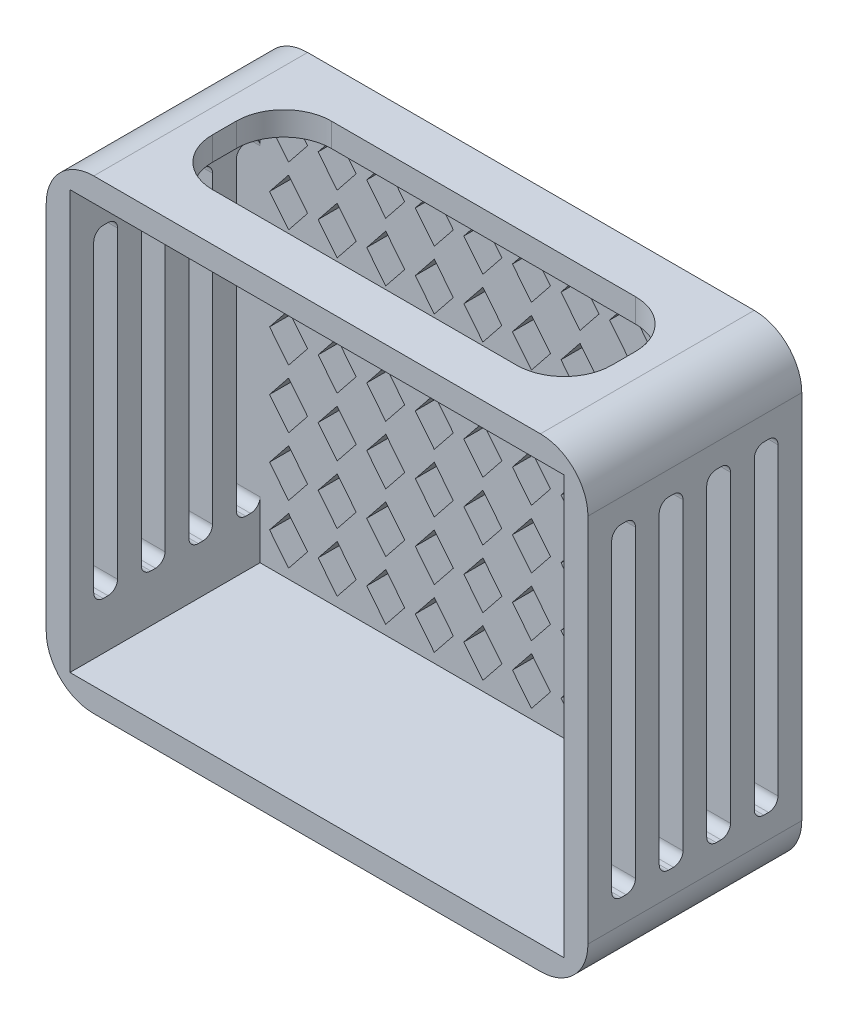
from build123d import *

# Parameters (mm, degrees)
SKETCH_1_W          = 114
SKETCH_1_H          = 98
EXTRUDE_2_DEPTH     = 45
SKETCH_3_W          = 104
SKETCH_3_H          = 88
CUT_EXTRUDE_2_DEPTH = 40
FILLET_1_R          = 10
FILLET_2_R          = 10
FILLET_3_R          = 10
FILLET_4_R          = 10
CUT_EXTRUDE_3_DEPTH = 10
CUT_EXTRUDE_4_DEPTH = 10
CUT_EXTRUDE_5_DEPTH = 150


with BuildPart() as part:
    # 草图1 → 凸台-拉伸2 (new body)
    with BuildSketch(Plane.XY):
        with Locations((57, 49)):
            Rectangle(SKETCH_1_W, SKETCH_1_H)
    extrude(amount=-EXTRUDE_2_DEPTH)

    # 草图3 → 切除-拉伸2 (cut)
    with BuildSketch(Plane.XY):
        with Locations((57, 49)):
            Rectangle(SKETCH_3_W, SKETCH_3_H)
    extrude(amount=-CUT_EXTRUDE_2_DEPTH, mode=Mode.SUBTRACT)

    # 圆角1
    fillet_1_edges = [part.edges().sort_by_distance(p)[0] for p in [
        (0, 98, -22.5),
    ]]
    fillet(fillet_1_edges, radius=FILLET_1_R)

    # 圆角2
    fillet_2_edges = [part.edges().sort_by_distance(p)[0] for p in [
        (0, 0, -22.5),
    ]]
    fillet(fillet_2_edges, radius=FILLET_2_R)

    # 圆角3
    fillet_3_edges = [part.edges().sort_by_distance(p)[0] for p in [
        (114, 0, -22.5),
    ]]
    fillet(fillet_3_edges, radius=FILLET_3_R)

    # 圆角4
    fillet_4_edges = [part.edges().sort_by_distance(p)[0] for p in [
        (114, 98, -22.5),
    ]]
    fillet(fillet_4_edges, radius=FILLET_4_R)

    # 草图5 → 切除-拉伸3 (cut)
    with BuildSketch(Plane(origin=(0, 0, -45), x_dir=(-1, 0, 0), z_dir=(0, 0, -1))):
        Polygon((-103, 91), (-107, 86), (-103, 81), (-99, 86), align=None)
        Polygon((-92.777777778, 91), (-96.777777778, 86), (-92.777777778, 81), (-88.777777778, 86), align=None)
        Polygon((-82.555555556, 91), (-86.555555556, 86), (-82.555555556, 81), (-78.555555556, 86), align=None)
        Polygon((-72.333333333, 91), (-76.333333333, 86), (-72.333333333, 81), (-68.333333333, 86), align=None)
        Polygon((-62.111111111, 91), (-66.111111111, 86), (-62.111111111, 81), (-58.111111111, 86), align=None)
        Polygon((-51.888888889, 91), (-55.888888889, 86), (-51.888888889, 81), (-47.888888889, 86), align=None)
        Polygon((-41.666666667, 91), (-45.666666667, 86), (-41.666666667, 81), (-37.666666667, 86), align=None)
        Polygon((-31.444444444, 91), (-35.444444444, 86), (-31.444444444, 81), (-27.444444444, 86), align=None)
        Polygon((-21.222222222, 91), (-25.222222222, 86), (-21.222222222, 81), (-17.222222222, 86), align=None)
        Polygon((-11, 91), (-15, 86), (-11, 81), (-7, 86), align=None)
        Polygon((-92.777777778, 78.666666667), (-96.777777778, 73.666666667), (-92.777777778, 68.666666667), (-88.777777778, 73.666666667), align=None)
        Polygon((-82.555555556, 78.666666667), (-86.555555556, 73.666666667), (-82.555555556, 68.666666667), (-78.555555556, 73.666666667), align=None)
        Polygon((-72.333333333, 78.666666667), (-76.333333333, 73.666666667), (-72.333333333, 68.666666667), (-68.333333333, 73.666666667), align=None)
        Polygon((-62.111111111, 78.666666667), (-66.111111111, 73.666666667), (-62.111111111, 68.666666667), (-58.111111111, 73.666666667), align=None)
        Polygon((-51.888888889, 78.666666667), (-55.888888889, 73.666666667), (-51.888888889, 68.666666667), (-47.888888889, 73.666666667), align=None)
        Polygon((-41.666666667, 78.666666667), (-45.666666667, 73.666666667), (-41.666666667, 68.666666667), (-37.666666667, 73.666666667), align=None)
        Polygon((-31.444444444, 78.666666667), (-35.444444444, 73.666666667), (-31.444444444, 68.666666667), (-27.444444444, 73.666666667), align=None)
        Polygon((-21.222222222, 78.666666667), (-25.222222222, 73.666666667), (-21.222222222, 68.666666667), (-17.222222222, 73.666666667), align=None)
        Polygon((-11, 78.666666667), (-15, 73.666666667), (-11, 68.666666667), (-7, 73.666666667), align=None)
        Polygon((-92.777777778, 66.333333333), (-96.777777778, 61.333333333), (-92.777777778, 56.333333333), (-88.777777778, 61.333333333), align=None)
        Polygon((-82.555555556, 66.333333333), (-86.555555556, 61.333333333), (-82.555555556, 56.333333333), (-78.555555556, 61.333333333), align=None)
        Polygon((-72.333333333, 66.333333333), (-76.333333333, 61.333333333), (-72.333333333, 56.333333333), (-68.333333333, 61.333333333), align=None)
        Polygon((-62.111111111, 66.333333333), (-66.111111111, 61.333333333), (-62.111111111, 56.333333333), (-58.111111111, 61.333333333), align=None)
        Polygon((-51.888888889, 66.333333333), (-55.888888889, 61.333333333), (-51.888888889, 56.333333333), (-47.888888889, 61.333333333), align=None)
        Polygon((-41.666666667, 66.333333333), (-45.666666667, 61.333333333), (-41.666666667, 56.333333333), (-37.666666667, 61.333333333), align=None)
        Polygon((-31.444444444, 66.333333333), (-35.444444444, 61.333333333), (-31.444444444, 56.333333333), (-27.444444444, 61.333333333), align=None)
        Polygon((-21.222222222, 66.333333333), (-25.222222222, 61.333333333), (-21.222222222, 56.333333333), (-17.222222222, 61.333333333), align=None)
        Polygon((-11, 66.333333333), (-15, 61.333333333), (-11, 56.333333333), (-7, 61.333333333), align=None)
        Polygon((-92.777777778, 54), (-96.777777778, 49), (-92.777777778, 44), (-88.777777778, 49), align=None)
        Polygon((-82.555555556, 54), (-86.555555556, 49), (-82.555555556, 44), (-78.555555556, 49), align=None)
        Polygon((-72.333333333, 54), (-76.333333333, 49), (-72.333333333, 44), (-68.333333333, 49), align=None)
        Polygon((-62.111111111, 54), (-66.111111111, 49), (-62.111111111, 44), (-58.111111111, 49), align=None)
        Polygon((-51.888888889, 54), (-55.888888889, 49), (-51.888888889, 44), (-47.888888889, 49), align=None)
        Polygon((-41.666666667, 54), (-45.666666667, 49), (-41.666666667, 44), (-37.666666667, 49), align=None)
        Polygon((-31.444444444, 54), (-35.444444444, 49), (-31.444444444, 44), (-27.444444444, 49), align=None)
        Polygon((-21.222222222, 54), (-25.222222222, 49), (-21.222222222, 44), (-17.222222222, 49), align=None)
        Polygon((-11, 54), (-15, 49), (-11, 44), (-7, 49), align=None)
        Polygon((-92.777777778, 41.666666667), (-96.777777778, 36.666666667), (-92.777777778, 31.666666667), (-88.777777778, 36.666666667), align=None)
        Polygon((-82.555555556, 41.666666667), (-86.555555556, 36.666666667), (-82.555555556, 31.666666667), (-78.555555556, 36.666666667), align=None)
        Polygon((-72.333333333, 41.666666667), (-76.333333333, 36.666666667), (-72.333333333, 31.666666667), (-68.333333333, 36.666666667), align=None)
        Polygon((-62.111111111, 41.666666667), (-66.111111111, 36.666666667), (-62.111111111, 31.666666667), (-58.111111111, 36.666666667), align=None)
        Polygon((-51.888888889, 41.666666667), (-55.888888889, 36.666666667), (-51.888888889, 31.666666667), (-47.888888889, 36.666666667), align=None)
        Polygon((-41.666666667, 41.666666667), (-45.666666667, 36.666666667), (-41.666666667, 31.666666667), (-37.666666667, 36.666666667), align=None)
        Polygon((-31.444444444, 41.666666667), (-35.444444444, 36.666666667), (-31.444444444, 31.666666667), (-27.444444444, 36.666666667), align=None)
        Polygon((-21.222222222, 41.666666667), (-25.222222222, 36.666666667), (-21.222222222, 31.666666667), (-17.222222222, 36.666666667), align=None)
        Polygon((-11, 41.666666667), (-15, 36.666666667), (-11, 31.666666667), (-7, 36.666666667), align=None)
        Polygon((-92.777777778, 29.333333333), (-96.777777778, 24.333333333), (-92.777777778, 19.333333333), (-88.777777778, 24.333333333), align=None)
        Polygon((-82.555555556, 29.333333333), (-86.555555556, 24.333333333), (-82.555555556, 19.333333333), (-78.555555556, 24.333333333), align=None)
        Polygon((-72.333333333, 29.333333333), (-76.333333333, 24.333333333), (-72.333333333, 19.333333333), (-68.333333333, 24.333333333), align=None)
        Polygon((-62.111111111, 29.333333333), (-66.111111111, 24.333333333), (-62.111111111, 19.333333333), (-58.111111111, 24.333333333), align=None)
        Polygon((-51.888888889, 29.333333333), (-55.888888889, 24.333333333), (-51.888888889, 19.333333333), (-47.888888889, 24.333333333), align=None)
        Polygon((-41.666666667, 29.333333333), (-45.666666667, 24.333333333), (-41.666666667, 19.333333333), (-37.666666667, 24.333333333), align=None)
        Polygon((-31.444444444, 29.333333333), (-35.444444444, 24.333333333), (-31.444444444, 19.333333333), (-27.444444444, 24.333333333), align=None)
        Polygon((-21.222222222, 29.333333333), (-25.222222222, 24.333333333), (-21.222222222, 19.333333333), (-17.222222222, 24.333333333), align=None)
        Polygon((-11, 29.333333333), (-15, 24.333333333), (-11, 19.333333333), (-7, 24.333333333), align=None)
        Polygon((-92.777777778, 17), (-96.777777778, 12), (-92.777777778, 7), (-88.777777778, 12), align=None)
        Polygon((-82.555555556, 17), (-86.555555556, 12), (-82.555555556, 7), (-78.555555556, 12), align=None)
        Polygon((-72.333333333, 17), (-76.333333333, 12), (-72.333333333, 7), (-68.333333333, 12), align=None)
        Polygon((-62.111111111, 17), (-66.111111111, 12), (-62.111111111, 7), (-58.111111111, 12), align=None)
        Polygon((-51.888888889, 17), (-55.888888889, 12), (-51.888888889, 7), (-47.888888889, 12), align=None)
        Polygon((-41.666666667, 17), (-45.666666667, 12), (-41.666666667, 7), (-37.666666667, 12), align=None)
        Polygon((-31.444444444, 17), (-35.444444444, 12), (-31.444444444, 7), (-27.444444444, 12), align=None)
        Polygon((-21.222222222, 17), (-25.222222222, 12), (-21.222222222, 7), (-17.222222222, 12), align=None)
        Polygon((-11, 17), (-15, 12), (-11, 7), (-7, 12), align=None)
        Polygon((-103, 78.666666667), (-107, 73.666666667), (-103, 68.666666667), (-99, 73.666666667), align=None)
        Polygon((-103, 66.333333333), (-107, 61.333333333), (-103, 56.333333333), (-99, 61.333333333), align=None)
        Polygon((-103, 54), (-107, 49), (-103, 44), (-99, 49), align=None)
        Polygon((-103, 41.666666667), (-107, 36.666666667), (-103, 31.666666667), (-99, 36.666666667), align=None)
        Polygon((-103, 29.333333333), (-107, 24.333333333), (-103, 19.333333333), (-99, 24.333333333), align=None)
        Polygon((-103, 17), (-107, 12), (-103, 7), (-99, 12), align=None)
    extrude(amount=-CUT_EXTRUDE_3_DEPTH, mode=Mode.SUBTRACT)

    # 草图4 → 切除-拉伸4 (cut)
    with BuildSketch(Plane(origin=(0, 98, 0), x_dir=(1, 0, 0), z_dir=(0, 1, 0))):
        with BuildLine():
            Line((25, 35), (89, 35))
            ThreePointArc((89, 35), (96.071067812, 32.071067812), (99, 25))
            Line((99, 25), (99, 20))
            ThreePointArc((99, 20), (96.071067812, 12.928932188), (89, 10))
            Line((89, 10), (25, 10))
            ThreePointArc((25, 10), (17.928932188, 12.928932188), (15, 20))
            Line((15, 20), (15, 25))
            ThreePointArc((15, 25), (17.928932188, 32.071067812), (25, 35))
        make_face()
    extrude(amount=-CUT_EXTRUDE_4_DEPTH, mode=Mode.SUBTRACT)

    # 草图6 → 切除-拉伸5 (cut)
    with BuildSketch(Plane(origin=(114, 0, 0), x_dir=(0, 0, -1), z_dir=(1, 0, 0))):
        with BuildLine():
            Line((15, 81), (15, 17))
            ThreePointArc((15, 17), (15.585786438, 15.585786438), (17, 15))
            Line((17, 15), (18, 15))
            ThreePointArc((18, 15), (19.414213562, 15.585786438), (20, 17))
            Line((20, 17), (20, 81))
            ThreePointArc((20, 81), (19.414213562, 82.414213562), (18, 83))
            Line((18, 83), (17, 83))
            ThreePointArc((17, 83), (15.585786438, 82.414213562), (15, 81))
        make_face()
        with BuildLine():
            Line((7, 83), (8, 83))
            ThreePointArc((8, 83), (9.414213562, 82.414213562), (10, 81))
            Line((10, 81), (10, 17))
            ThreePointArc((10, 17), (9.414213562, 15.585786438), (8, 15))
            Line((8, 15), (7, 15))
            ThreePointArc((7, 15), (5.585786438, 15.585786438), (5, 17))
            Line((5, 17), (5, 81))
            ThreePointArc((5, 81), (5.585786438, 82.414213562), (7, 83))
        make_face()
        with BuildLine():
            Line((25, 81), (25, 17))
            ThreePointArc((25, 17), (25.585786438, 15.585786438), (27, 15))
            Line((27, 15), (28, 15))
            ThreePointArc((28, 15), (29.414213562, 15.585786438), (30, 17))
            Line((30, 17), (30, 81))
            ThreePointArc((30, 81), (29.414213562, 82.414213562), (28, 83))
            Line((28, 83), (27, 83))
            ThreePointArc((27, 83), (25.585786438, 82.414213562), (25, 81))
        make_face()
        with BuildLine():
            Line((35, 81), (35, 17))
            ThreePointArc((35, 17), (35.585786438, 15.585786438), (37, 15))
            Line((37, 15), (38, 15))
            ThreePointArc((38, 15), (39.414213562, 15.585786438), (40, 17))
            Line((40, 17), (40, 81))
            ThreePointArc((40, 81), (39.414213562, 82.414213562), (38, 83))
            Line((38, 83), (37, 83))
            ThreePointArc((37, 83), (35.585786438, 82.414213562), (35, 81))
        make_face()
    extrude(amount=-CUT_EXTRUDE_5_DEPTH, mode=Mode.SUBTRACT)


solid = part.part
